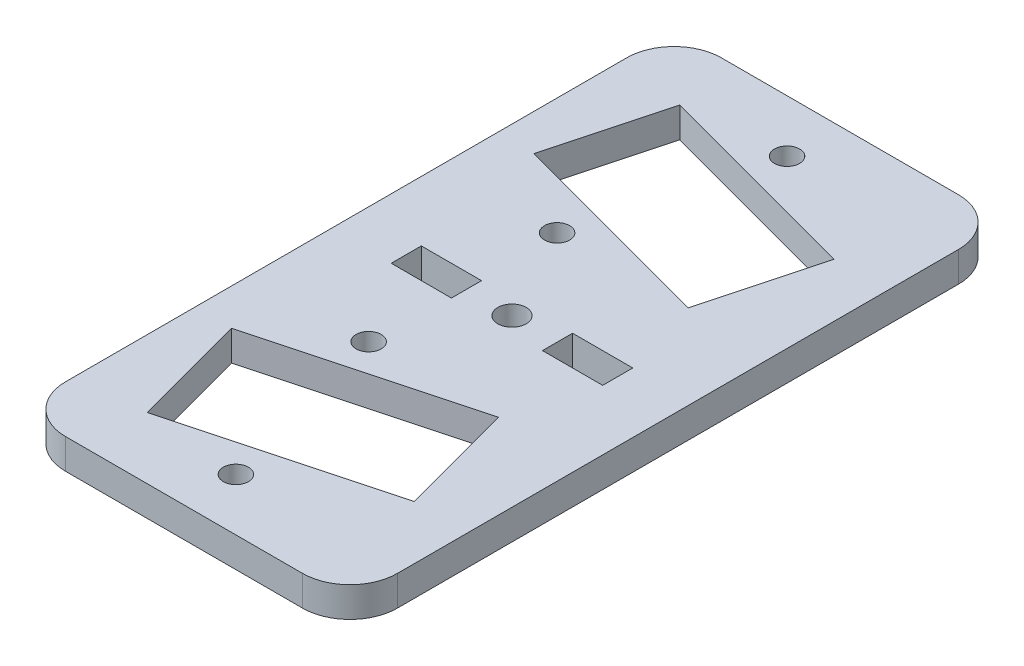
from build123d import *

# Parameters (mm, degrees)
SKETCH1_R           = 1.324800001
SKETCH1_R_2         = 1.5
SKETCH1_W           = 6.35
SKETCH1_H           = 3.175
BOSS_EXTRUDE1_DEPTH = 3.175


with BuildPart() as part:
    # Sketch1 → Boss-Extrude1 (new body)
    with BuildSketch(Plane(origin=(0, 0, 0), x_dir=(1, 0, 0), z_dir=(0, 1, 0))):
        with BuildLine():
            Line((241.90748173, 29.781172289), (266.90748173, 29.781172289))
            ThreePointArc((266.90748173, 29.781172289), (270.443015636, 28.316706195), (271.90748173, 24.781172289))
            Line((271.90748173, 24.781172289), (271.90748173, -34.394734405))
            ThreePointArc((271.90748173, -34.394734405), (270.443015636, -37.930268311), (266.90748173, -39.394734405))
            Line((266.90748173, -39.394734405), (241.90748173, -39.394734405))
            ThreePointArc((241.90748173, -39.394734405), (238.371947824, -37.930268311), (236.90748173, -34.394734405))
            Line((236.90748173, -34.394734405), (236.90748173, 24.781172289))
            ThreePointArc((236.90748173, 24.781172289), (238.371947824, 28.316706195), (241.90748173, 29.781172289))
        make_face()
        with Locations(Location((254.350862197, 24.256669994, 0), (0, 0, 270))):
            Circle(SKETCH1_R, mode=Mode.SUBTRACT)
        with Locations(Location((249.226245104, 5.131338633, 0), (0, 0, 90))):
            Circle(SKETCH1_R, mode=Mode.SUBTRACT)
        with Locations(Location((249.226245104, -14.744900749, 0), (0, 0, 270))):
            Circle(SKETCH1_R, mode=Mode.SUBTRACT)
        with Locations(Location((254.350862197, -33.870232109, 0), (0, 0, 90))):
            Circle(SKETCH1_R, mode=Mode.SUBTRACT)
        with Locations(Location((254.40748173, -4.806781058, 0), (0, 0, 270))):
            Circle(SKETCH1_R_2, mode=Mode.SUBTRACT)
        Polygon((240.775666346, 11.14605698), (262.991960351, 5.193218942), (266.241381147, 17.32022245), (244.025087143, 23.273060488), align=None, mode=Mode.SUBTRACT)
        Polygon((262.991960351, -14.806781058), (266.241381147, -26.933784566), (244.025087143, -32.886622603), (240.775666346, -20.759619095), align=None, mode=Mode.SUBTRACT)
        with Locations((246.43248173, -4.806781058)):
            Rectangle(SKETCH1_W, SKETCH1_H, mode=Mode.SUBTRACT)
        with Locations((262.38248173, -4.806781058)):
            Rectangle(SKETCH1_W, SKETCH1_H, mode=Mode.SUBTRACT)
    extrude(amount=BOSS_EXTRUDE1_DEPTH)


solid = part.part
